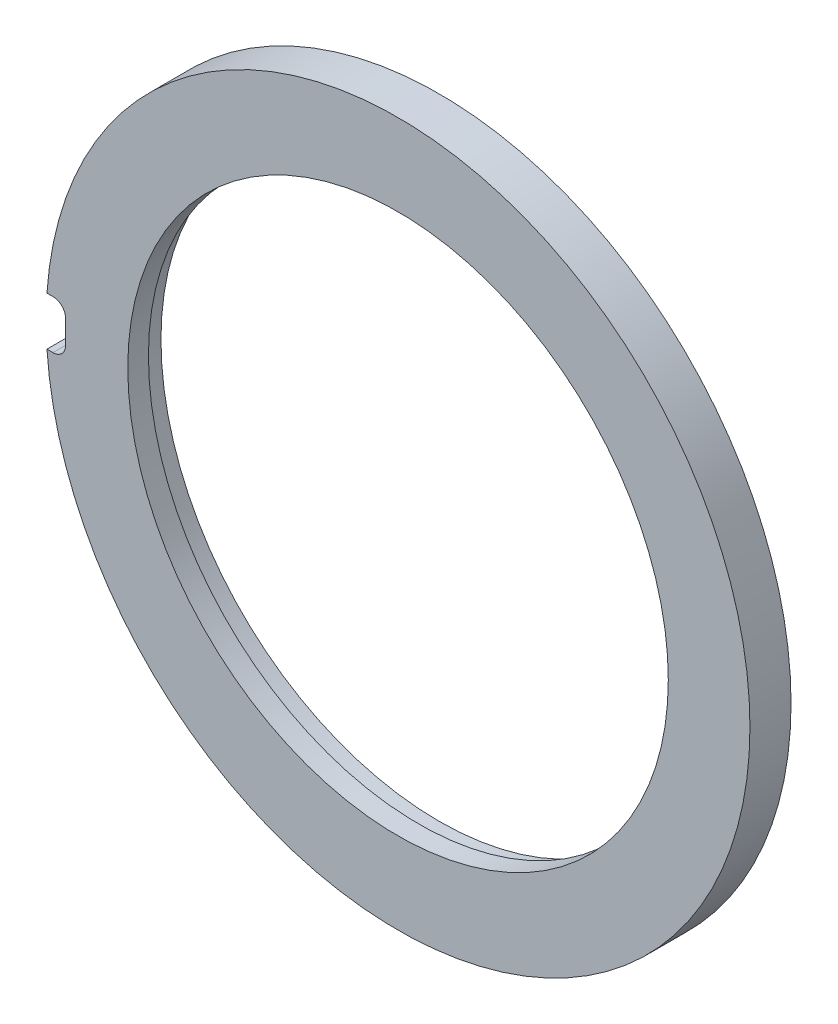
from build123d import *

# Parameters (mm, degrees)
CUT_EXTRUDE_1_DEPTH = 3
FILLET_2_R          = 0.6


with BuildPart() as part:
    # Эскиз1 → Повернуть1 (revolve)
    with BuildSketch(Plane(origin=(0, 0, 0), x_dir=(1, 0, 0), z_dir=(0, 1, 0)), mode=Mode.PRIVATE) as revolve_1_sk:
        Polygon((-16.7, 0), (-12.825, 0), (-12.825, 0.98), (-13.2, 0.98), (-13.2, 1.95), (-16.7, 1.95), align=None)
    revolve(revolve_1_sk.sketch.rotate(Axis((0, 0, 0), (0, 0, -1)), 180), axis=Axis((0, 0, 0), (0, 0, -1)))

    # Эскиз2 → Вырез-Вытянуть1 (cut)
    with BuildSketch(Plane(origin=(0, 0, -1.95), x_dir=(-1, 0, 0), z_dir=(0, 0, -1))):
        with BuildLine():
            Line((16.660357139, 1.15), (15.773622825, 1.15))
            Line((15.773622825, 1.15), (15.773622825, -1.15))
            Line((15.773622825, -1.15), (16.660357139, -1.15))
            ThreePointArc((16.660357139, -1.15), (16.850858655, 0), (16.660357139, 1.15))
        make_face()
    extrude(amount=-CUT_EXTRUDE_1_DEPTH, mode=Mode.SUBTRACT)

    # Скругление2
    fillet_2_edges = [part.edges().sort_by_distance(p)[0] for p in [
        (-15.773622825, -1.15, -0.975),
        (-15.773622825, 1.15, -0.975),
    ]]
    fillet(fillet_2_edges, radius=FILLET_2_R)


solid = part.part
